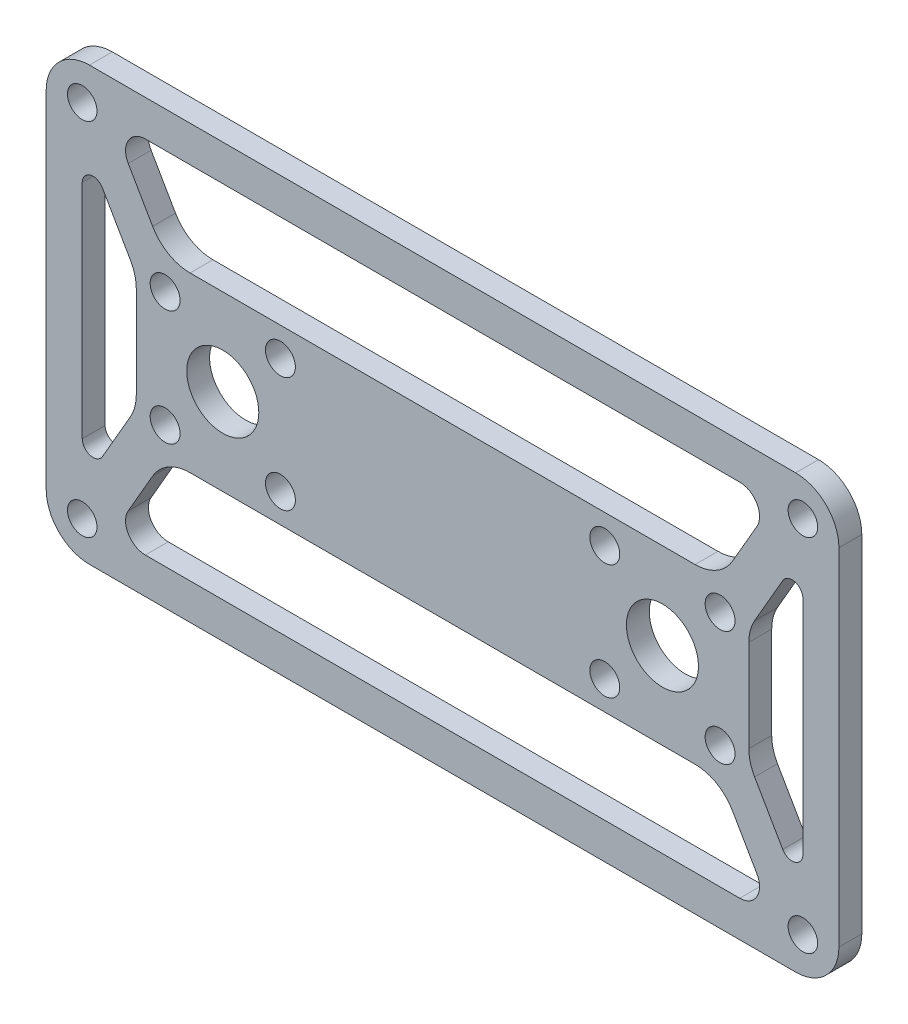
from build123d import *

# Parameters (mm, degrees)
SKETCH1_R           = 5
SKETCH1_R_2         = 2.075
SKETCH1_R_3         = 2.05
BOSS_EXTRUDE1_DEPTH = 3.175


with BuildPart() as part:
    # Sketch1 → Boss-Extrude1 (new body)
    with BuildSketch(Plane(origin=(0, 0, 0), x_dir=(-1, 0, 0), z_dir=(0, 0, -1))):
        with BuildLine():
            Line((49, 30), (-49, 30))
            ThreePointArc((-49, 30), (-53.242640687, 28.242640687), (-55, 24))
            Line((-55, 24), (-55, -24))
            ThreePointArc((-55, -24), (-53.242640687, -28.242640687), (-49, -30))
            Line((-49, -30), (49, -30))
            ThreePointArc((49, -30), (53.242640687, -28.242640687), (55, -24))
            Line((55, -24), (55, 24))
            ThreePointArc((55, 24), (53.242640687, 28.242640687), (49, 30))
        make_face()
        with Locations(Location((-30.51, 0, 0), (0, 0, 180))):
            Circle(SKETCH1_R, mode=Mode.SUBTRACT)
        with Locations(Location((30.5, 0, 0), (0, 0, 180))):
            Circle(SKETCH1_R, mode=Mode.SUBTRACT)
        with Locations(Location((-22.51, -8, 0), (0, 0, 180))):
            Circle(SKETCH1_R_2, mode=Mode.SUBTRACT)
        with Locations(Location((-38.51, -8, 0), (0, 0, 180))):
            Circle(SKETCH1_R_2, mode=Mode.SUBTRACT)
        with Locations(Location((-38.51, 8, 0), (0, 0, 180))):
            Circle(SKETCH1_R_2, mode=Mode.SUBTRACT)
        with Locations(Location((-22.51, 8, 0), (0, 0, 180))):
            Circle(SKETCH1_R_2, mode=Mode.SUBTRACT)
        with Locations(Location((38.5, -8, 0), (0, 0, 180))):
            Circle(SKETCH1_R_2, mode=Mode.SUBTRACT)
        with Locations(Location((22.5, -8, 0), (0, 0, 180))):
            Circle(SKETCH1_R_2, mode=Mode.SUBTRACT)
        with Locations(Location((22.5, 8, 0), (0, 0, 180))):
            Circle(SKETCH1_R_2, mode=Mode.SUBTRACT)
        with Locations(Location((38.5, 8, 0), (0, 0, 180))):
            Circle(SKETCH1_R_2, mode=Mode.SUBTRACT)
        with Locations(Location((50, -25, 0), (0, 0, 180))):
            Circle(SKETCH1_R_3, mode=Mode.SUBTRACT)
        with Locations(Location((-50, -25, 0), (0, 0, 180))):
            Circle(SKETCH1_R_3, mode=Mode.SUBTRACT)
        with Locations(Location((-50, 25, 0), (0, 0, 180))):
            Circle(SKETCH1_R_3, mode=Mode.SUBTRACT)
        with Locations(Location((50, 25, 0), (0, 0, 180))):
            Circle(SKETCH1_R_3, mode=Mode.SUBTRACT)
        with BuildLine():
            Line((-42.5, 6.393335184), (-42.5, -6.393335184))
            ThreePointArc((-42.5, -6.393335184), (-42.704196298, -7.945320832), (-43.302886484, -9.391669905))
            Line((-43.302886484, -9.391669905), (-47.200721621, -16.147917476))
            ThreePointArc((-47.200721621, -16.147917476), (-48.887996412, -16.847284721), (-50, -15.398333796))
            Line((-50, -15.398333796), (-50, 15.398333796))
            ThreePointArc((-50, 15.398333796), (-48.887996412, 16.847284721), (-47.200721621, 16.147917476))
            Line((-47.200721621, 16.147917476), (-43.302886484, 9.391669905))
            ThreePointArc((-43.302886484, 9.391669905), (-42.704196298, 7.945320832), (-42.5, 6.393335184))
        make_face(mode=Mode.SUBTRACT)
        with BuildLine():
            Line((-35.034616452, -12), (35.034616452, -12))
            ThreePointArc((35.034616452, -12), (38.035448976, -12.804328324), (40.231729969, -15.001665279))
            Line((40.231729969, -15.001665279), (43.620632646, -20.875763253))
            ThreePointArc((43.620632646, -20.875763253), (43.619971802, -23.625381574), (41.238622284, -25))
            Line((41.238622284, -25), (-41.238622284, -25))
            ThreePointArc((-41.238622284, -25), (-43.619971802, -23.625381574), (-43.620632646, -20.875763253))
            Line((-43.620632646, -20.875763253), (-40.231729969, -15.001665279))
            ThreePointArc((-40.231729969, -15.001665279), (-38.035448976, -12.804328324), (-35.034616452, -12))
        make_face(mode=Mode.SUBTRACT)
        with BuildLine():
            Line((42.5, -6.393335184), (42.5, 6.393335184))
            ThreePointArc((42.5, 6.393335184), (42.704196298, 7.945320832), (43.302886484, 9.391669905))
            Line((43.302886484, 9.391669905), (47.200721621, 16.147917476))
            ThreePointArc((47.200721621, 16.147917476), (48.887996412, 16.847284721), (50, 15.398333796))
            Line((50, 15.398333796), (50, -15.398333796))
            ThreePointArc((50, -15.398333796), (48.887996412, -16.847284721), (47.200721621, -16.147917476))
            Line((47.200721621, -16.147917476), (43.302886484, -9.391669905))
            ThreePointArc((43.302886484, -9.391669905), (42.704196298, -7.945320832), (42.5, -6.393335184))
        make_face(mode=Mode.SUBTRACT)
        with BuildLine():
            Line((35.034616452, 12), (-35.034616452, 12))
            ThreePointArc((-35.034616452, 12), (-38.035448976, 12.804328324), (-40.231729969, 15.001665279))
            Line((-40.231729969, 15.001665279), (-43.620632646, 20.875763253))
            ThreePointArc((-43.620632646, 20.875763253), (-43.619971802, 23.625381574), (-41.238622284, 25))
            Line((-41.238622284, 25), (41.238622284, 25))
            ThreePointArc((41.238622284, 25), (43.619971802, 23.625381574), (43.620632646, 20.875763253))
            Line((43.620632646, 20.875763253), (40.231729969, 15.001665279))
            ThreePointArc((40.231729969, 15.001665279), (38.035448976, 12.804328324), (35.034616452, 12))
        make_face(mode=Mode.SUBTRACT)
    extrude(amount=-BOSS_EXTRUDE1_DEPTH)


solid = part.part
